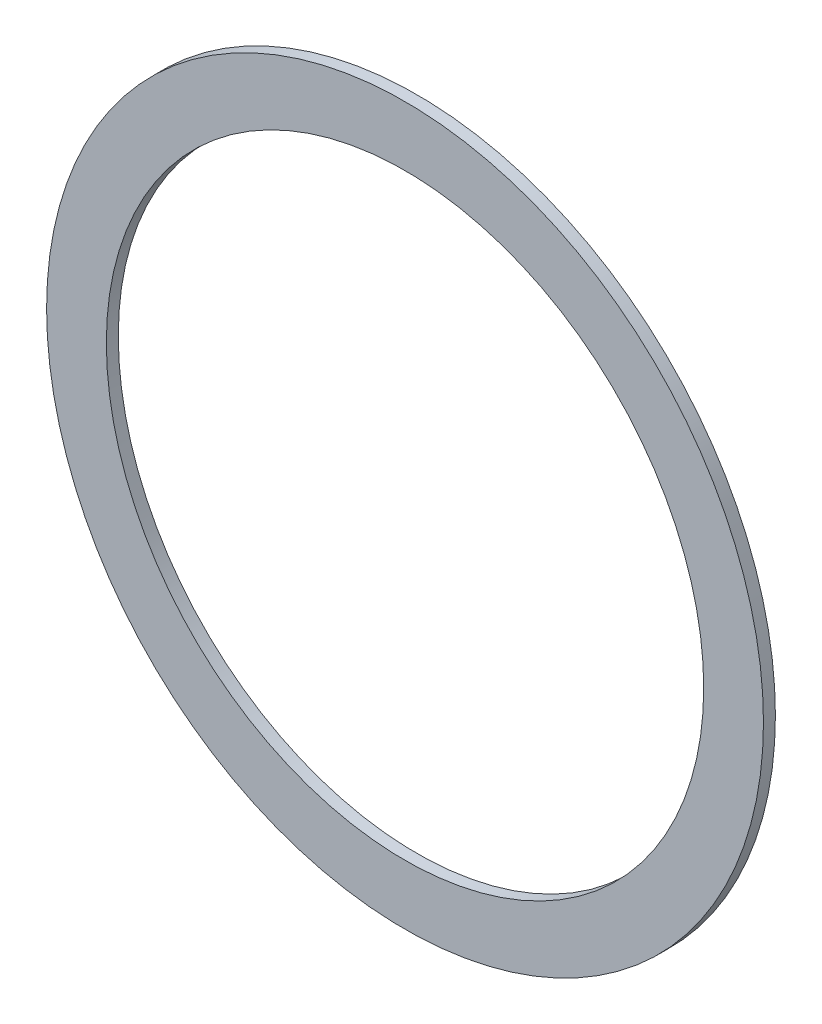
from build123d import *

# Parameters (mm, degrees)
SKETCH_1_R      = 6
SKETCH_1_R_2    = 5
EXTRUDE_1_DEPTH = 0.1


with BuildPart() as part:
    # 草图1 → 凸台-拉伸1 (new, symmetric)
    with BuildSketch(Plane.XY):
        Circle(SKETCH_1_R)
        Circle(SKETCH_1_R_2, mode=Mode.SUBTRACT)
    extrude(amount=EXTRUDE_1_DEPTH, both=True)


solid = part.part
